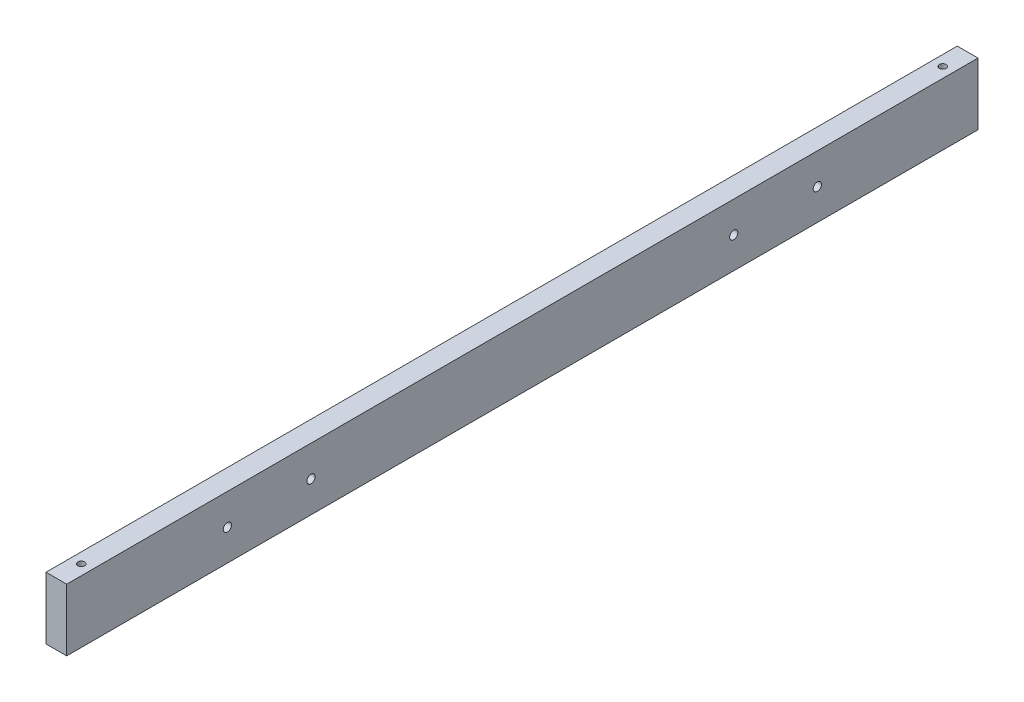
from build123d import *

# Parameters (mm, degrees)
SKETCH1_W               = 10
SKETCH1_H               = 30
BOSS_EXTRUDE1_DEPTH     = 440
ESQUISSE1_R             = 1.65
ENL_V_MAT_EXTRU_1_DEPTH = 442.134900002
ESQUISSE2_R             = 2
ENL_V_MAT_EXTRU_2_DEPTH = 442.134900002


with BuildPart() as part:
    # Sketch1 → Boss-Extrude1 (new body)
    with BuildSketch(Plane.XY):
        with Locations((5, 15)):
            Rectangle(SKETCH1_W, SKETCH1_H)
    extrude(amount=BOSS_EXTRUDE1_DEPTH)

    # Esquisse1 → Enlèv. mat.-Extru.1 (cut, through all)
    with BuildSketch(Plane(origin=(0, 30, 0), x_dir=(1, 0, 0), z_dir=(0, 1, 0))):
        with Locations(Location((5, -428, 0), (0, 0, 270))):
            Circle(ESQUISSE1_R)
        with Locations(Location((5, -12, 0), (0, 0, 270))):
            Circle(ESQUISSE1_R)
    extrude(amount=-ENL_V_MAT_EXTRU_1_DEPTH, mode=Mode.SUBTRACT)

    # Esquisse2 → Enlèv. mat.-Extru.2 (cut, through all)
    with BuildSketch(Plane(origin=(10, 0, 0), x_dir=(0, 0, -1), z_dir=(1, 0, 0))):
        with Locations((-362.425, 15)):
            Circle(ESQUISSE2_R)
        with Locations((-77.575, 15)):
            Circle(ESQUISSE2_R)
        with Locations((-322.04, 15)):
            Circle(ESQUISSE2_R)
        with Locations((-117.96, 15)):
            Circle(ESQUISSE2_R)
    extrude(amount=-ENL_V_MAT_EXTRU_2_DEPTH, mode=Mode.SUBTRACT)


solid = part.part
